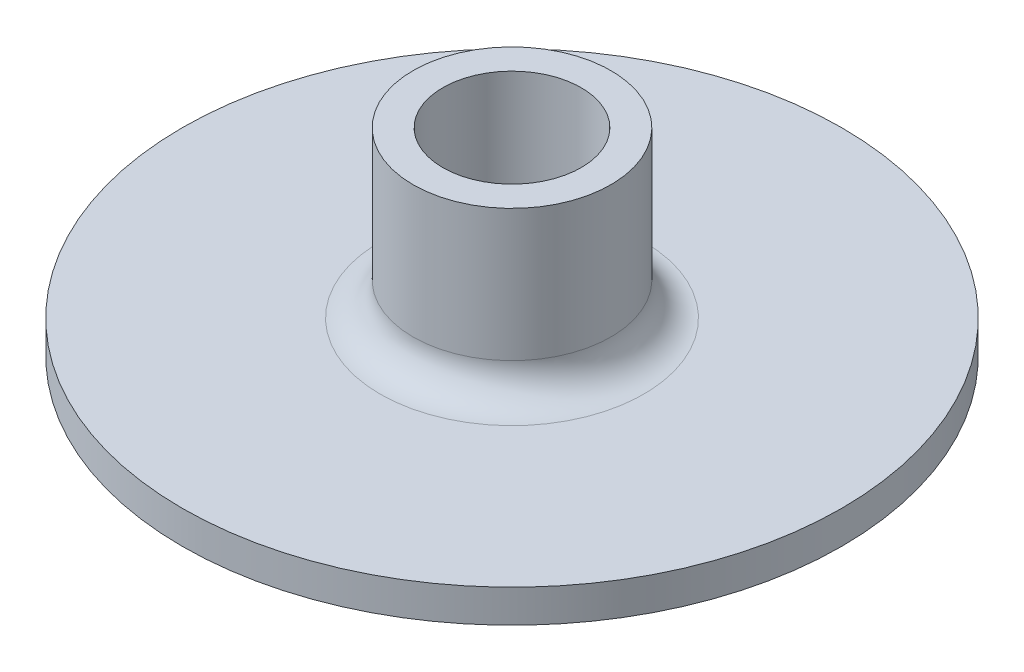
from build123d import *

# Parameters (mm, degrees)
SKETCH_1_R          = 50
SKETCH_1_R_2        = 10.5
EXTRUDE_1_DEPTH     = 30
SKETCH_2_R          = 54.511418905
SKETCH_2_R_2        = 15
CUT_EXTRUDE_2_DEPTH = 25
SKETCH_3_R          = 28
SKETCH_3_R_2        = 19
SKETCH_3_R_3        = 1.5
EXTRUDE_3_DEPTH     = 9
SKETCH_4_R          = 22.1
CUT_EXTRUDE_4_DEPTH = 3
FILLET_3_R          = 5


with BuildPart() as part:
    # Эскиз1 → Вытянуть1 (new body)
    with BuildSketch(Plane(origin=(0, 0, 0), x_dir=(1, 0, 0), z_dir=(0, 1, 0))):
        with Locations(Location((0, 0, 0), (0, 0, 270))):
            Circle(SKETCH_1_R)
        with Locations(Location((0, 0, 0), (0, 0, 270))):
            Circle(SKETCH_1_R_2, mode=Mode.SUBTRACT)
    extrude(amount=EXTRUDE_1_DEPTH)

    # Эскиз2 → Вытянуть2 (cut)
    with BuildSketch(Plane(origin=(0, 30, 0), x_dir=(1, 0, 0), z_dir=(0, 1, 0))):
        Circle(SKETCH_2_R)
        with Locations(Location((0, 0, 0), (0, 0, 270))):
            Circle(SKETCH_2_R_2, mode=Mode.SUBTRACT)
    extrude(amount=-CUT_EXTRUDE_2_DEPTH, mode=Mode.SUBTRACT)

    # Эскиз3 → Вытянуть3 (add)
    with BuildSketch(Plane.XZ):
        with Locations(Location((0, 0, 0), (0, 0, 90))):
            Circle(SKETCH_3_R)
        with Locations(Location((0, 0, 0), (0, 0, 270))):
            Circle(SKETCH_3_R_2, mode=Mode.SUBTRACT)
        with Locations(Location((0, 25, 0), (0, 0, 270))):
            Circle(SKETCH_3_R_3, mode=Mode.SUBTRACT)
        with Locations(Location((25, 0, 0), (0, 0, 270))):
            Circle(SKETCH_3_R_3, mode=Mode.SUBTRACT)
        with Locations(Location((0, -25, 0), (0, 0, 270))):
            Circle(SKETCH_3_R_3, mode=Mode.SUBTRACT)
        with Locations(Location((-25, 0, 0), (0, 0, 270))):
            Circle(SKETCH_3_R_3, mode=Mode.SUBTRACT)
    extrude(amount=EXTRUDE_3_DEPTH)

    # Эскиз4 → Вытянуть4 (cut)
    with BuildSketch(Plane.XZ.offset(9)):
        with Locations(Location((0, 0, 0), (0, 0, 270))):
            Circle(SKETCH_4_R)
    extrude(amount=-CUT_EXTRUDE_4_DEPTH, mode=Mode.SUBTRACT)

    # Скругление3
    fillet_3_edges = [part.edges().sort_by_distance(p)[0] for p in [
        (0, 5, -15),
    ]]
    fillet(fillet_3_edges, radius=FILLET_3_R)


solid = part.part
